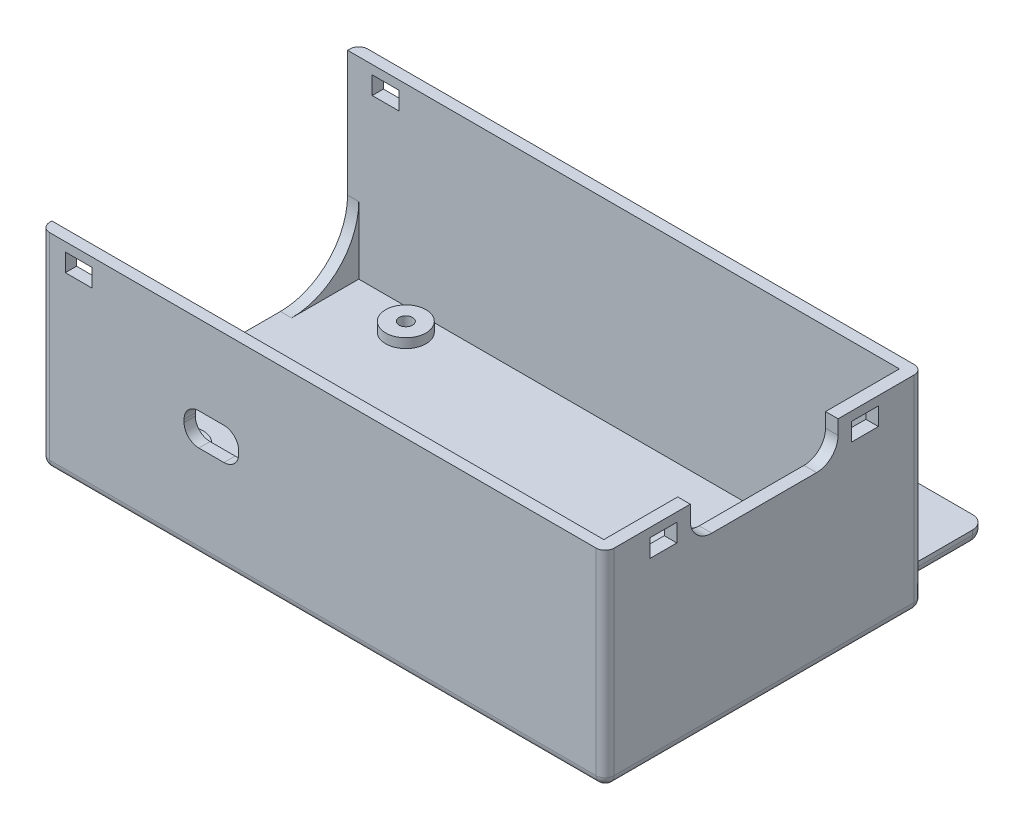
from build123d import *

# Parameters (mm, degrees)
SKETCH1_W           = 126
SKETCH1_H           = 71
BOSS_EXTRUDE1_DEPTH = 46
SKETCH2_W           = 20
SKETCH2_H           = 20.5
BOSS_EXTRUDE2_DEPTH = 3
SKETCH3_W           = 120.7
SKETCH3_H           = 66
CUT_EXTRUDE1_DEPTH  = 43
CUT_EXTRUDE2_REACH  = 147.355
CUT_EXTRUDE3_REACH  = 147.355
SKETCH5_W           = 6
SKETCH5_H           = 4
SKETCH6_W           = 6
SKETCH6_H           = 4
CUT_EXTRUDE4_DEPTH  = 121.238305045
CUT_EXTRUDE5_REACH  = 122.238
SKETCH8_R           = 2.4
CUT_EXTRUDE6_DEPTH  = 95.625577937
FILLET1_R           = 3
FILLET2_R           = 4
FILLET3_R           = 2
SKETCH9_R           = 4.5
BOSS_EXTRUDE3_DEPTH = 2.1
SKETCH10_R          = 1.5
CUT_EXTRUDE7_DEPTH  = 94.689967446


with BuildPart() as part:
    # Sketch1 → Boss-Extrude1 (new body)
    with BuildSketch(Plane(origin=(0, 0, 0), x_dir=(1, 0, 0), z_dir=(0, 1, 0))):
        Rectangle(SKETCH1_W, SKETCH1_H)
    extrude(amount=BOSS_EXTRUDE1_DEPTH)

    # Sketch2 → Boss-Extrude2 (add)
    with BuildSketch(Plane.XZ):
        with Locations((-46.5, -45.75)):
            Rectangle(SKETCH2_W, SKETCH2_H)
        with Locations((46.5, -45.75)):
            Rectangle(SKETCH2_W, SKETCH2_H)
    extrude(amount=-BOSS_EXTRUDE2_DEPTH)

    # Sketch3 → Cut-Extrude1 (cut)
    with BuildSketch(Plane(origin=(0, 46, 0), x_dir=(1, 0, 0), z_dir=(0, 1, 0))):
        with Locations((-0.15, 0)):
            Rectangle(SKETCH3_W, SKETCH3_H)
    extrude(amount=-CUT_EXTRUDE1_DEPTH, mode=Mode.SUBTRACT)

    # Sketch4 → Cut-Extrude2 (cut, up to next)
    with BuildSketch(Plane.ZY.offset(63), mode=Mode.PRIVATE) as cut_extrude2_sk1:
        with BuildLine():
            Line((-33, 46), (33, 46))
            Line((33, 46), (33, 18))
            ThreePointArc((33, 18), (28.606601718, 7.393398282), (18, 3))
            Line((18, 3), (-18, 3))
            ThreePointArc((-18, 3), (-28.606601718, 7.393398282), (-33, 18))
            Line((-33, 18), (-33, 46))
        make_face()
    cut_extrude2_tool1 = extrude(cut_extrude2_sk1.sketch, amount=-CUT_EXTRUDE2_REACH, mode=Mode.PRIVATE) & part.part
    add(cut_extrude2_tool1.solids().sort_by_distance((-63, 25.139342, 0))[0], mode=Mode.SUBTRACT)

    # Sketch5 → Cut-Extrude3 (cut, up to next)
    with BuildSketch(Plane(origin=(63, 0, 0), x_dir=(0, 0, -1), z_dir=(1, 0, 0)), mode=Mode.PRIVATE) as cut_extrude3_sk1:
        with BuildLine():
            Line((-16.5, 46), (16.5, 46))
            Line((16.5, 46), (16.5, 42.8))
            ThreePointArc((16.5, 42.8), (15.09411255, 39.40588745), (11.7, 38))
            Line((11.7, 38), (-11.7, 38))
            ThreePointArc((-11.7, 38), (-15.09411255, 39.40588745), (-16.5, 42.8))
            Line((-16.5, 42.8), (-16.5, 46))
        make_face()
    cut_extrude3_tool1 = extrude(cut_extrude3_sk1.sketch, amount=-CUT_EXTRUDE3_REACH, mode=Mode.PRIVATE) & part.part
    # Sketch5 → Cut-Extrude3 (cut, up to next)
    with BuildSketch(Plane(origin=(63, 0, 0), x_dir=(0, 0, -1), z_dir=(1, 0, 0)), mode=Mode.PRIVATE) as cut_extrude3_sk2:
        with Locations((22.5, 42)):
            Rectangle(SKETCH5_W, SKETCH5_H)
    cut_extrude3_tool2 = extrude(cut_extrude3_sk2.sketch, amount=-CUT_EXTRUDE3_REACH, mode=Mode.PRIVATE) & part.part
    # Sketch5 → Cut-Extrude3 (cut, up to next)
    with BuildSketch(Plane(origin=(63, 0, 0), x_dir=(0, 0, -1), z_dir=(1, 0, 0)), mode=Mode.PRIVATE) as cut_extrude3_sk3:
        with Locations((-22.5, 42)):
            Rectangle(SKETCH5_W, SKETCH5_H)
    cut_extrude3_tool3 = extrude(cut_extrude3_sk3.sketch, amount=-CUT_EXTRUDE3_REACH, mode=Mode.PRIVATE) & part.part
    add(cut_extrude3_tool1.solids().sort_by_distance((63, 42.113938, 0))[0], mode=Mode.SUBTRACT)
    add(cut_extrude3_tool2.solids().sort_by_distance((63, 42, -22.5))[0], mode=Mode.SUBTRACT)
    add(cut_extrude3_tool3.solids().sort_by_distance((63, 42, 22.5))[0], mode=Mode.SUBTRACT)

    # Sketch6 → Cut-Extrude4 (cut, through all)
    with BuildSketch(Plane.XY.offset(35.5)):
        with Locations((-54.5, 42)):
            Rectangle(SKETCH6_W, SKETCH6_H)
    extrude(amount=-CUT_EXTRUDE4_DEPTH, mode=Mode.SUBTRACT)

    # Sketch7 → Cut-Extrude5 (cut, up to next)
    with BuildSketch(Plane.XY.offset(35.5), mode=Mode.PRIVATE) as cut_extrude5_sk1:
        with BuildLine():
            Line((-27.7, 28.2), (-22.1, 28.2))
            ThreePointArc((-22.1, 28.2), (-19.766547622, 27.233452378), (-18.8, 24.9))
            Line((-18.8, 24.9), (-18.8, 24.3))
            ThreePointArc((-18.8, 24.3), (-19.766547622, 21.966547622), (-22.1, 21))
            Line((-22.1, 21), (-27.7, 21))
            ThreePointArc((-27.7, 21), (-30.033452378, 21.966547622), (-31, 24.3))
            Line((-31, 24.3), (-31, 24.9))
            ThreePointArc((-31, 24.9), (-30.033452378, 27.233452378), (-27.7, 28.2))
        make_face()
    cut_extrude5_tool1 = extrude(cut_extrude5_sk1.sketch, amount=-CUT_EXTRUDE5_REACH, mode=Mode.PRIVATE) & part.part
    add(cut_extrude5_tool1.solids().sort_by_distance((-24.9, 24.6, 35.5))[0], mode=Mode.SUBTRACT)

    # Sketch8 → Cut-Extrude6 (cut, through all)
    with BuildSketch(Plane(origin=(0, 3, 0), x_dir=(1, 0, 0), z_dir=(0, 1, 0))):
        with Locations(Location((-46.5, 46, 0), (0, 0, 270))):
            Circle(SKETCH8_R)
        with Locations(Location((46.5, 46, 0), (0, 0, 270))):
            Circle(SKETCH8_R)
    extrude(amount=-CUT_EXTRUDE6_DEPTH, mode=Mode.SUBTRACT)

    # Fillet1
    fillet1_edges = [part.edges().sort_by_distance(p)[0] for p in [
        (36.5, 1.5, -56),
        (56.5, 1.5, -56),
        (-36.5, 1.5, -56),
        (-56.5, 1.5, -56),
    ]]
    fillet(fillet1_edges, radius=FILLET1_R)

    # Fillet2
    fillet2_edges = [part.edges().sort_by_distance(p)[0] for p in [
        (-56.5, 1.5, -35.5),
        (-36.5, 1.5, -35.5),
        (56.5, 1.5, -35.5),
        (36.5, 1.5, -35.5),
    ]]
    fillet(fillet2_edges, radius=FILLET2_R)

    # Fillet3
    fillet3_edges = [part.edges().sort_by_distance(p)[0] for p in [
        (-46.5, 0, -56),
        (-36.5, 0, -46.25),
        (46.5, 0, -56),
        (56.5, 0, -46.25),
        (-55.621320344, 0, -55.121320344),
        (-37.378679656, 0, -55.121320344),
        (55.621320344, 0, -55.121320344),
        (37.378679656, 0, -55.121320344),
        (0, 0, -35.5),
        (-61.75, 0, -35.5),
        (-56.5, 0, -46.25),
        (36.5, 0, -46.25),
        (-57.671572875, 0, -36.671572875),
        (-35.328427125, 0, -36.671572875),
        (57.671572875, 0, -36.671572875),
        (35.328427125, 0, -36.671572875),
        (0, 0, 35.5),
        (-63, 0, 0),
        (61.75, 0, -35.5),
        (63, 0, 0),
        (63, 23, 35.5),
        (-63, 23, 35.5),
        (-63, 23, -35.5),
        (63, 23, -35.5),
    ]]
    fillet(fillet3_edges, radius=FILLET3_R)

    # Sketch9 → Boss-Extrude3 (add)
    with BuildSketch(Plane(origin=(0, 3, 0), x_dir=(1, 0, 0), z_dir=(0, 1, 0))):
        with Locations(Location((-45, 28, 0), (0, 0, 270))):
            Circle(SKETCH9_R)
        with Locations(Location((-46.4, -20.3, 0), (0, 0, 270))):
            Circle(SKETCH9_R)
        with Locations(Location((31, 18, 0), (0, 0, 270))):
            Circle(SKETCH9_R)
        with Locations(Location((36.6, -20.3, 0), (0, 0, 270))):
            Circle(SKETCH9_R)
    extrude(amount=BOSS_EXTRUDE3_DEPTH)

    # Sketch10 → Cut-Extrude7 (cut, through all)
    with BuildSketch(Plane(origin=(0, 5.1, 0), x_dir=(1, 0, 0), z_dir=(0, 1, 0))):
        with Locations(Location((-45, 28, 0), (0, 0, 270))):
            Circle(SKETCH10_R)
        with Locations(Location((-46.4, -20.3, 0), (0, 0, 270))):
            Circle(SKETCH10_R)
        with Locations(Location((36.6, -20.3, 0), (0, 0, 270))):
            Circle(SKETCH10_R)
    extrude(amount=-CUT_EXTRUDE7_DEPTH, mode=Mode.SUBTRACT)


solid = part.part
